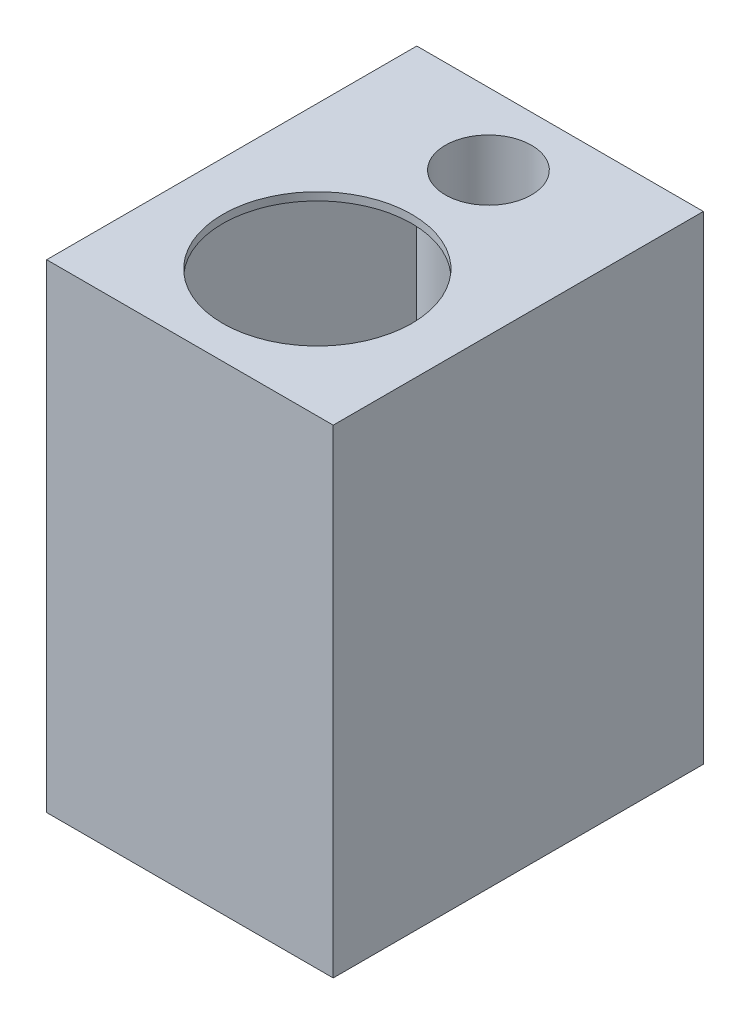
from build123d import *

# Parameters (mm, degrees)
SKETCH2_W           = 144
SKETCH2_H           = 186
BOSS_EXTRUDE1_DEPTH = 4
SKETCH3_W           = 144
SKETCH3_H           = 186
SKETCH3_W_2         = 136
SKETCH3_H_2         = 178
BOSS_EXTRUDE2_DEPTH = 236.6
SKETCH4_R           = 47.5
CUT_EXTRUDE1_DEPTH  = 4
SKETCH5_R           = 21.65
CUT_EXTRUDE2_DEPTH  = 4
BOSS_EXTRUDE3_START = 103.7
SKETCH6_R           = 25.65
SKETCH6_R_2         = 21.65
BOSS_EXTRUDE3_DEPTH = 103.7


with BuildPart() as part:
    # Sketch2 → Boss-Extrude1 (new body)
    with BuildSketch(Plane(origin=(0, 0, 0), x_dir=(1, 0, 0), z_dir=(0, 1, 0))):
        with Locations((72, 93)):
            Rectangle(SKETCH2_W, SKETCH2_H)
    extrude(amount=BOSS_EXTRUDE1_DEPTH)

    # Sketch3 → Boss-Extrude2 (add)
    with BuildSketch(Plane(origin=(0, 0, 0), x_dir=(-1, 0, 0), z_dir=(0, -1, 0))):
        with Locations((-72, 93)):
            Rectangle(SKETCH3_W, SKETCH3_H)
        with Locations((-72, 93)):
            Rectangle(SKETCH3_W_2, SKETCH3_H_2, mode=Mode.SUBTRACT)
    extrude(amount=BOSS_EXTRUDE2_DEPTH)

    # Sketch4 → Cut-Extrude1 (cut)
    with BuildSketch(Plane(origin=(0, 4, 0), x_dir=(1, 0, 0), z_dir=(0, 1, 0))):
        with Locations(Location((72, 64, 0), (0, 0, 270))):
            Circle(SKETCH4_R)
    extrude(amount=-CUT_EXTRUDE1_DEPTH, mode=Mode.SUBTRACT)

    # Sketch5 → Cut-Extrude2 (cut)
    with BuildSketch(Plane(origin=(0, 0, 0), x_dir=(-1, 0, 0), z_dir=(0, -1, 0))):
        with Locations(Location((-72, 150, 0), (0, 0, 90))):
            Circle(SKETCH5_R)
    extrude(amount=-CUT_EXTRUDE2_DEPTH, mode=Mode.SUBTRACT)

    # Sketch6 → Boss-Extrude3 (add)
    with BuildSketch(Plane(origin=(0, 0, 0), x_dir=(-1, 0, 0), z_dir=(0, -1, 0)).offset(BOSS_EXTRUDE3_START)):
        with Locations(Location((-72, 150, 0), (0, 0, 270))):
            Circle(SKETCH6_R)
        with Locations(Location((-72, 150, 0), (0, 0, 90))):
            Circle(SKETCH6_R_2, mode=Mode.SUBTRACT)
    extrude(amount=-BOSS_EXTRUDE3_DEPTH)


solid = part.part
